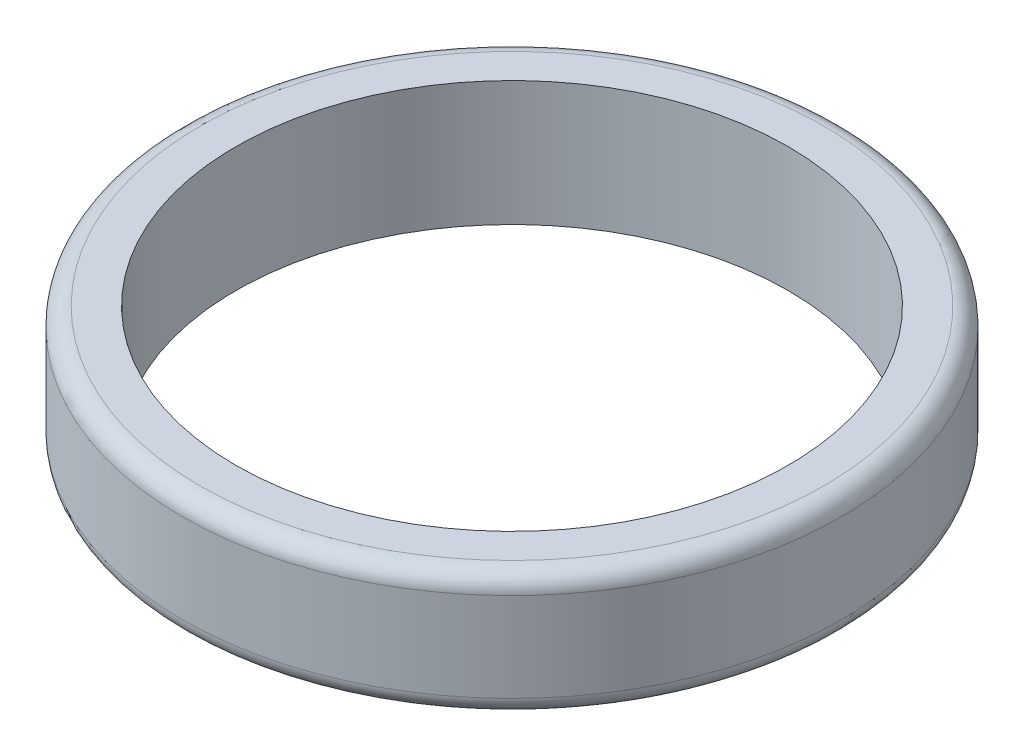
from build123d import *

# Parameters (mm, degrees)
SKETCH1_R           = 18.5
SKETCH1_R_2         = 15.5
BOSS_EXTRUDE1_DEPTH = 7
FILLET1_R           = 1


with BuildPart() as part:
    # Sketch1 → Boss-Extrude1 (new body)
    with BuildSketch(Plane(origin=(0, 0, 0), x_dir=(1, 0, 0), z_dir=(0, 1, 0))):
        with Locations(Location((0, 0, 0), (0, 0, 270))):
            Circle(SKETCH1_R)
        with Locations(Location((0, 0, 0), (0, 0, 270))):
            Circle(SKETCH1_R_2, mode=Mode.SUBTRACT)
    extrude(amount=BOSS_EXTRUDE1_DEPTH)

    # Fillet1
    fillet1_edges = [part.edges().sort_by_distance(p)[0] for p in [
        (0, 0, -18.5),
        (0, 7, -18.5),
    ]]
    fillet(fillet1_edges, radius=FILLET1_R)


solid = part.part
